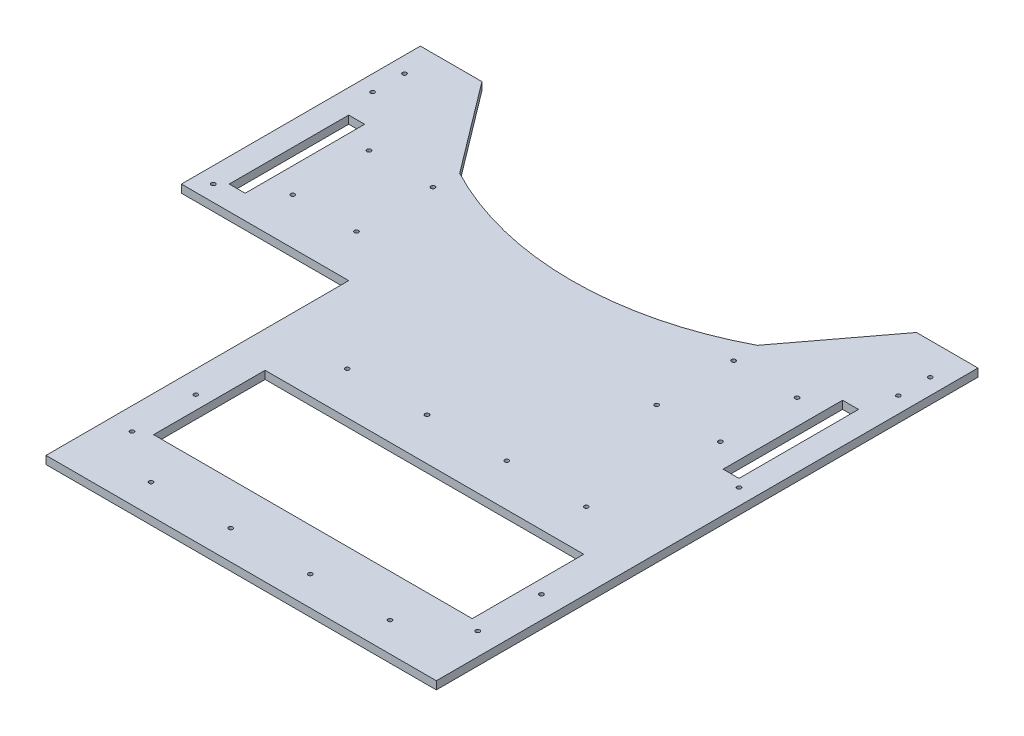
from build123d import *

# Parameters (mm, degrees)
SKETCH1_R           = 1.63195
SKETCH1_W           = 254
SKETCH1_H           = 88.9
SKETCH1_W_2         = 12.7
SKETCH1_H_2         = 95.25
BOSS_EXTRUDE1_DEPTH = 6.35
CUT_EXTRUDE1_REACH  = 621.735
SKETCH2_R           = 1.63195
CUT_EXTRUDE2_REACH  = 621.735
SKETCH4_R           = 1.63195


with BuildPart() as part:
    # Sketch1 → Boss-Extrude1 (new body)
    with BuildSketch(Plane(origin=(0, 0, 0), x_dir=(1, 0, 0), z_dir=(0, 1, 0))):
        with BuildLine():
            Line((-444.5, 431.8), (-395.456941666, 431.8))
            Line((-395.456941666, 431.8), (-340.943704665, 359.56166268))
            ThreePointArc((-340.943704665, 359.56166268), (-222.25, 330.203093028), (-103.556295335, 359.56166268))
            Line((-103.556295335, 359.56166268), (-49.043058334, 431.8))
            Line((-49.043058334, 431.8), (0, 431.8))
            Line((0, 431.8), (0, 0))
            Line((0, 0), (-311.15, 0))
            Line((-311.15, 0), (-311.15, 241.3))
            Line((-311.15, 241.3), (-444.5, 241.3))
            Line((-444.5, 241.3), (-444.5, 431.8))
        make_face()
        with Locations(Location((-250.825, 23.368, 0), (0, 0, 270))):
            Circle(SKETCH1_R, mode=Mode.SUBTRACT)
        with Locations(Location((-187.325, 23.368, 0), (0, 0, 270))):
            Circle(SKETCH1_R, mode=Mode.SUBTRACT)
        with Locations(Location((-187.325, 179.8955, 0), (0, 0, 270))):
            Circle(SKETCH1_R, mode=Mode.SUBTRACT)
        with Locations(Location((-250.825, 179.8955, 0), (0, 0, 270))):
            Circle(SKETCH1_R, mode=Mode.SUBTRACT)
        with Locations(Location((-123.825, 179.8955, 0), (0, 0, 270))):
            Circle(SKETCH1_R, mode=Mode.SUBTRACT)
        with Locations(Location((-60.325, 179.8955, 0), (0, 0, 270))):
            Circle(SKETCH1_R, mode=Mode.SUBTRACT)
        with Locations(Location((-123.825, 23.368, 0), (0, 0, 270))):
            Circle(SKETCH1_R, mode=Mode.SUBTRACT)
        with Locations(Location((-60.325, 23.368, 0), (0, 0, 270))):
            Circle(SKETCH1_R, mode=Mode.SUBTRACT)
        with Locations((-155.575, 101.63175)):
            Rectangle(SKETCH1_W, SKETCH1_H, mode=Mode.SUBTRACT)
        with Locations((-25.4, 307.975)):
            Rectangle(SKETCH1_W_2, SKETCH1_H_2, mode=Mode.SUBTRACT)
        with Locations((-419.1, 307.975)):
            Rectangle(SKETCH1_W_2, SKETCH1_H_2, mode=Mode.SUBTRACT)
    extrude(amount=BOSS_EXTRUDE1_DEPTH)

    # Sketch2 → Cut-Extrude1 (cut, up to next)
    with BuildSketch(Plane(origin=(0, 6.35, 0), x_dir=(1, 0, 0), z_dir=(0, 1, 0)), mode=Mode.PRIVATE) as cut_extrude1_sk1:
        with Locations(Location((-293.37, 101.6, 0), (0, 0, 270))):
            Circle(SKETCH2_R)
    cut_extrude1_tool1 = extrude(cut_extrude1_sk1.sketch, amount=-CUT_EXTRUDE1_REACH, mode=Mode.PRIVATE) & part.part
    # Sketch2 → Cut-Extrude1 (cut, up to next)
    with BuildSketch(Plane(origin=(0, 6.35, 0), x_dir=(1, 0, 0), z_dir=(0, 1, 0)), mode=Mode.PRIVATE) as cut_extrude1_sk2:
        with Locations(Location((-293.37, 50.8, 0), (0, 0, 270))):
            Circle(SKETCH2_R)
    cut_extrude1_tool2 = extrude(cut_extrude1_sk2.sketch, amount=-CUT_EXTRUDE1_REACH, mode=Mode.PRIVATE) & part.part
    # Sketch2 → Cut-Extrude1 (cut, up to next)
    with BuildSketch(Plane(origin=(0, 6.35, 0), x_dir=(1, 0, 0), z_dir=(0, 1, 0)), mode=Mode.PRIVATE) as cut_extrude1_sk3:
        with Locations(Location((-17.78, 101.6, 0), (0, 0, 270))):
            Circle(SKETCH2_R)
    cut_extrude1_tool3 = extrude(cut_extrude1_sk3.sketch, amount=-CUT_EXTRUDE1_REACH, mode=Mode.PRIVATE) & part.part
    # Sketch2 → Cut-Extrude1 (cut, up to next)
    with BuildSketch(Plane(origin=(0, 6.35, 0), x_dir=(1, 0, 0), z_dir=(0, 1, 0)), mode=Mode.PRIVATE) as cut_extrude1_sk4:
        with Locations(Location((-17.78, 50.8, 0), (0, 0, 270))):
            Circle(SKETCH2_R)
    cut_extrude1_tool4 = extrude(cut_extrude1_sk4.sketch, amount=-CUT_EXTRUDE1_REACH, mode=Mode.PRIVATE) & part.part
    add(cut_extrude1_tool1.solids().sort_by_distance((-293.37, 6.35, -101.6))[0], mode=Mode.SUBTRACT)
    add(cut_extrude1_tool2.solids().sort_by_distance((-293.37, 6.35, -50.8))[0], mode=Mode.SUBTRACT)
    add(cut_extrude1_tool3.solids().sort_by_distance((-17.78, 6.35, -101.6))[0], mode=Mode.SUBTRACT)
    add(cut_extrude1_tool4.solids().sort_by_distance((-17.78, 6.35, -50.8))[0], mode=Mode.SUBTRACT)

    # Sketch4 → Cut-Extrude2 (cut, up to next)
    with BuildSketch(Plane(origin=(0, 6.35, 0), x_dir=(1, 0, 0), z_dir=(0, 1, 0)), mode=Mode.PRIVATE) as cut_extrude2_sk1:
        with Locations(Location((-102.439928105, 339.392140239, 0), (0, 0, 270))):
            Circle(SKETCH4_R)
    cut_extrude2_tool1 = extrude(cut_extrude2_sk1.sketch, amount=-CUT_EXTRUDE2_REACH, mode=Mode.PRIVATE) & part.part
    # Sketch4 → Cut-Extrude2 (cut, up to next)
    with BuildSketch(Plane(origin=(0, 6.35, 0), x_dir=(1, 0, 0), z_dir=(0, 1, 0)), mode=Mode.PRIVATE) as cut_extrude2_sk2:
        with Locations(Location((-51.640295705, 339.198883781, 0), (0, 0, 270))):
            Circle(SKETCH4_R)
    cut_extrude2_tool2 = extrude(cut_extrude2_sk2.sketch, amount=-CUT_EXTRUDE2_REACH, mode=Mode.PRIVATE) & part.part
    # Sketch4 → Cut-Extrude2 (cut, up to next)
    with BuildSketch(Plane(origin=(0, 6.35, 0), x_dir=(1, 0, 0), z_dir=(0, 1, 0)), mode=Mode.PRIVATE) as cut_extrude2_sk3:
        with Locations(Location((-102.55625, 278.238883781, 0), (0, 0, 270))):
            Circle(SKETCH4_R)
    cut_extrude2_tool3 = extrude(cut_extrude2_sk3.sketch, amount=-CUT_EXTRUDE2_REACH, mode=Mode.PRIVATE) & part.part
    # Sketch4 → Cut-Extrude2 (cut, up to next)
    with BuildSketch(Plane(origin=(0, 6.35, 0), x_dir=(1, 0, 0), z_dir=(0, 1, 0)), mode=Mode.PRIVATE) as cut_extrude2_sk4:
        with Locations(Location((-51.75625, 278.238883781, 0), (0, 0, 270))):
            Circle(SKETCH4_R)
    cut_extrude2_tool4 = extrude(cut_extrude2_sk4.sketch, amount=-CUT_EXTRUDE2_REACH, mode=Mode.PRIVATE) & part.part
    # Sketch4 → Cut-Extrude2 (cut, up to next)
    with BuildSketch(Plane(origin=(0, 6.35, 0), x_dir=(1, 0, 0), z_dir=(0, 1, 0)), mode=Mode.PRIVATE) as cut_extrude2_sk5:
        with Locations(Location((-392.74375, 278.238883781, 0), (0, 0, 270))):
            Circle(SKETCH4_R)
    cut_extrude2_tool5 = extrude(cut_extrude2_sk5.sketch, amount=-CUT_EXTRUDE2_REACH, mode=Mode.PRIVATE) & part.part
    # Sketch4 → Cut-Extrude2 (cut, up to next)
    with BuildSketch(Plane(origin=(0, 6.35, 0), x_dir=(1, 0, 0), z_dir=(0, 1, 0)), mode=Mode.PRIVATE) as cut_extrude2_sk6:
        with Locations(Location((-341.94375, 278.238883781, 0), (0, 0, 270))):
            Circle(SKETCH4_R)
    cut_extrude2_tool6 = extrude(cut_extrude2_sk6.sketch, amount=-CUT_EXTRUDE2_REACH, mode=Mode.PRIVATE) & part.part
    # Sketch4 → Cut-Extrude2 (cut, up to next)
    with BuildSketch(Plane(origin=(0, 6.35, 0), x_dir=(1, 0, 0), z_dir=(0, 1, 0)), mode=Mode.PRIVATE) as cut_extrude2_sk7:
        with Locations(Location((-392.859704295, 339.198883781, 0), (0, 0, 270))):
            Circle(SKETCH4_R)
    cut_extrude2_tool7 = extrude(cut_extrude2_sk7.sketch, amount=-CUT_EXTRUDE2_REACH, mode=Mode.PRIVATE) & part.part
    # Sketch4 → Cut-Extrude2 (cut, up to next)
    with BuildSketch(Plane(origin=(0, 6.35, 0), x_dir=(1, 0, 0), z_dir=(0, 1, 0)), mode=Mode.PRIVATE) as cut_extrude2_sk8:
        with Locations(Location((-342.060071895, 339.392140239, 0), (0, 0, 270))):
            Circle(SKETCH4_R)
    cut_extrude2_tool8 = extrude(cut_extrude2_sk8.sketch, amount=-CUT_EXTRUDE2_REACH, mode=Mode.PRIVATE) & part.part
    # Sketch4 → Cut-Extrude2 (cut, up to next)
    with BuildSketch(Plane(origin=(0, 6.35, 0), x_dir=(1, 0, 0), z_dir=(0, 1, 0)), mode=Mode.PRIVATE) as cut_extrude2_sk9:
        with Locations(Location((-12.7, 406.4, 0), (0, 0, 270))):
            Circle(SKETCH4_R)
    cut_extrude2_tool9 = extrude(cut_extrude2_sk9.sketch, amount=-CUT_EXTRUDE2_REACH, mode=Mode.PRIVATE) & part.part
    # Sketch4 → Cut-Extrude2 (cut, up to next)
    with BuildSketch(Plane(origin=(0, 6.35, 0), x_dir=(1, 0, 0), z_dir=(0, 1, 0)), mode=Mode.PRIVATE) as cut_extrude2_sk10:
        with Locations(Location((-12.7, 381, 0), (0, 0, 270))):
            Circle(SKETCH4_R)
    cut_extrude2_tool10 = extrude(cut_extrude2_sk10.sketch, amount=-CUT_EXTRUDE2_REACH, mode=Mode.PRIVATE) & part.part
    # Sketch4 → Cut-Extrude2 (cut, up to next)
    with BuildSketch(Plane(origin=(0, 6.35, 0), x_dir=(1, 0, 0), z_dir=(0, 1, 0)), mode=Mode.PRIVATE) as cut_extrude2_sk11:
        with Locations(Location((-12.7, 254, 0), (0, 0, 270))):
            Circle(SKETCH4_R)
    cut_extrude2_tool11 = extrude(cut_extrude2_sk11.sketch, amount=-CUT_EXTRUDE2_REACH, mode=Mode.PRIVATE) & part.part
    # Sketch4 → Cut-Extrude2 (cut, up to next)
    with BuildSketch(Plane(origin=(0, 6.35, 0), x_dir=(1, 0, 0), z_dir=(0, 1, 0)), mode=Mode.PRIVATE) as cut_extrude2_sk12:
        with Locations(Location((-431.8, 254, 0), (0, 0, 270))):
            Circle(SKETCH4_R)
    cut_extrude2_tool12 = extrude(cut_extrude2_sk12.sketch, amount=-CUT_EXTRUDE2_REACH, mode=Mode.PRIVATE) & part.part
    # Sketch4 → Cut-Extrude2 (cut, up to next)
    with BuildSketch(Plane(origin=(0, 6.35, 0), x_dir=(1, 0, 0), z_dir=(0, 1, 0)), mode=Mode.PRIVATE) as cut_extrude2_sk13:
        with Locations(Location((-431.8, 381, 0), (0, 0, 270))):
            Circle(SKETCH4_R)
    cut_extrude2_tool13 = extrude(cut_extrude2_sk13.sketch, amount=-CUT_EXTRUDE2_REACH, mode=Mode.PRIVATE) & part.part
    # Sketch4 → Cut-Extrude2 (cut, up to next)
    with BuildSketch(Plane(origin=(0, 6.35, 0), x_dir=(1, 0, 0), z_dir=(0, 1, 0)), mode=Mode.PRIVATE) as cut_extrude2_sk14:
        with Locations(Location((-431.8, 406.4, 0), (0, 0, 270))):
            Circle(SKETCH4_R)
    cut_extrude2_tool14 = extrude(cut_extrude2_sk14.sketch, amount=-CUT_EXTRUDE2_REACH, mode=Mode.PRIVATE) & part.part
    add(cut_extrude2_tool1.solids().sort_by_distance((-102.439928, 6.35, -339.39214))[0], mode=Mode.SUBTRACT)
    add(cut_extrude2_tool2.solids().sort_by_distance((-51.640296, 6.35, -339.198884))[0], mode=Mode.SUBTRACT)
    add(cut_extrude2_tool3.solids().sort_by_distance((-102.55625, 6.35, -278.238884))[0], mode=Mode.SUBTRACT)
    add(cut_extrude2_tool4.solids().sort_by_distance((-51.75625, 6.35, -278.238884))[0], mode=Mode.SUBTRACT)
    add(cut_extrude2_tool5.solids().sort_by_distance((-392.74375, 6.35, -278.238884))[0], mode=Mode.SUBTRACT)
    add(cut_extrude2_tool6.solids().sort_by_distance((-341.94375, 6.35, -278.238884))[0], mode=Mode.SUBTRACT)
    add(cut_extrude2_tool7.solids().sort_by_distance((-392.859704, 6.35, -339.198884))[0], mode=Mode.SUBTRACT)
    add(cut_extrude2_tool8.solids().sort_by_distance((-342.060072, 6.35, -339.39214))[0], mode=Mode.SUBTRACT)
    add(cut_extrude2_tool9.solids().sort_by_distance((-12.7, 6.35, -406.4))[0], mode=Mode.SUBTRACT)
    add(cut_extrude2_tool10.solids().sort_by_distance((-12.7, 6.35, -381))[0], mode=Mode.SUBTRACT)
    add(cut_extrude2_tool11.solids().sort_by_distance((-12.7, 6.35, -254))[0], mode=Mode.SUBTRACT)
    add(cut_extrude2_tool12.solids().sort_by_distance((-431.8, 6.35, -254))[0], mode=Mode.SUBTRACT)
    add(cut_extrude2_tool13.solids().sort_by_distance((-431.8, 6.35, -381))[0], mode=Mode.SUBTRACT)
    add(cut_extrude2_tool14.solids().sort_by_distance((-431.8, 6.35, -406.4))[0], mode=Mode.SUBTRACT)


solid = part.part
